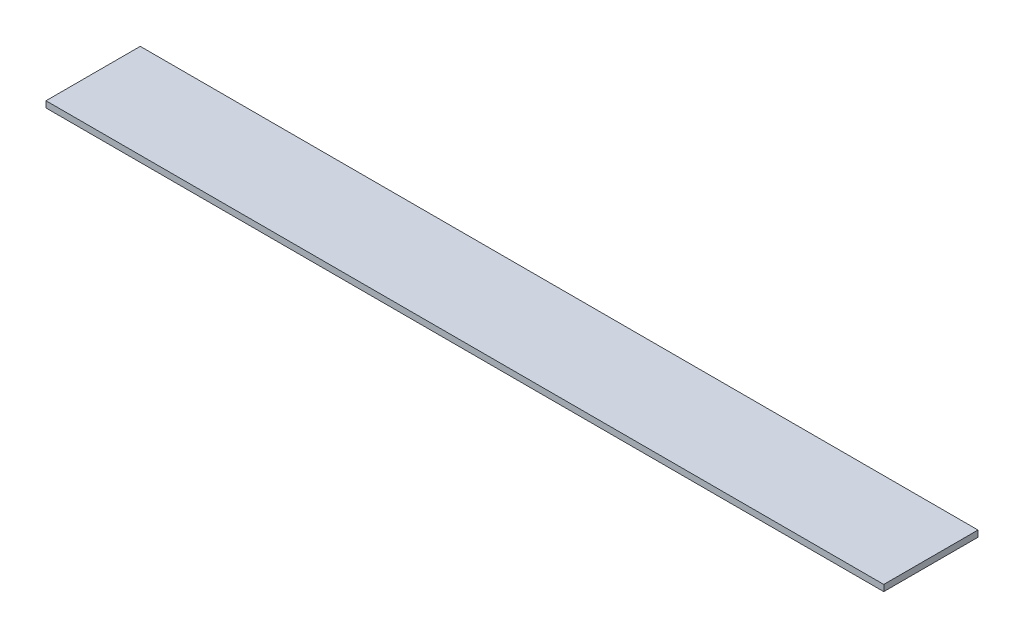
from build123d import *

# Parameters (mm, degrees)
SKETCH1_W           = 400
SKETCH1_H           = 45
BOSS_EXTRUDE1_DEPTH = 3


with BuildPart() as part:
    # Sketch1 → Boss-Extrude1 (new body)
    with BuildSketch(Plane(origin=(0, 0, 0), x_dir=(1, 0, 0), z_dir=(0, 1, 0))):
        with Locations((129.639039491, 27.400138321)):
            Rectangle(SKETCH1_W, SKETCH1_H)
    extrude(amount=BOSS_EXTRUDE1_DEPTH)


solid = part.part
